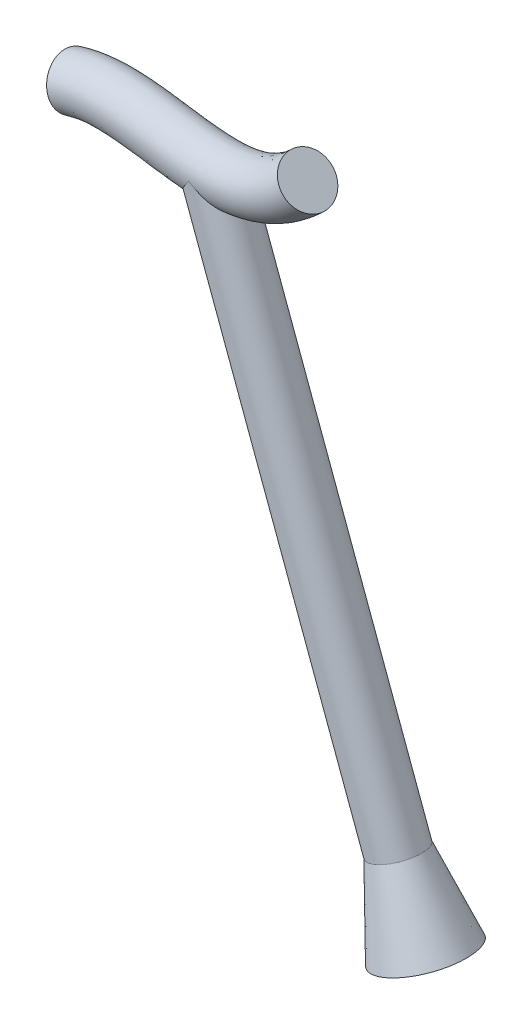
from build123d import *

# Parameters (mm, degrees)
CROQUIS8_R              = 12.5
SALIENTE_EXTRUIR1_REACH = 326.791
CROQUIS11_R             = 12.5


with BuildPart() as part:
    # Barrer2: sweep along a path in Croquis7
    with BuildLine() as barrer2_path:  # in the path sketch's own coordinates; laid on its plane below (add() does not lay a ready-made edge on the line's plane)
        add(Edge.make_bspline(
            [(0, 0), (40.063845147, 12.936685998), (79.927373916, -21.140368078), (118.219501425, 15.689998663)],
            knots=[0, 0, 0, 0, 1, 1, 1, 1], degree=3))
    # Croquis8 → Barrer2 (sweep)
    with BuildSketch(Plane(origin=(0, 0, 0), x_dir=(0, 0, -1), z_dir=(0.9516192950583919, 0.30727954255460815, 0))):
        Circle(CROQUIS8_R)
    sweep(path=Plane.XY * barrer2_path.line)

    # Croquis11 → Saliente-Extruir1 (add, up to next)
    with BuildSketch(Plane(origin=(163.655125908, -253.290566887, 0), x_dir=(0.9381132106931296, 0.34632875122205475, 0), z_dir=(-0.34632875122205475, 0.9381132106931296, 0)), mode=Mode.PRIVATE) as saliente_extruir1_sk1:
        with Locations(Location((0, 0, 0), (0, 0, 90))):
            Circle(CROQUIS11_R)
    saliente_extruir1_tool1 = extrude(saliente_extruir1_sk1.sketch, amount=SALIENTE_EXTRUIR1_REACH, mode=Mode.PRIVATE) - part.part
    add(saliente_extruir1_tool1.solids().sort_by_distance((163.655126, -253.290567, 0))[0])

    # Croquis12 → Revolución3 (revolve)
    with BuildSketch(Plane.XY):
        Polygon((163.655125908, -253.290566887), (175.381541042, -248.961457497), (198.146766592, -283.195862788), (177.508275957, -290.815095315), align=None)
    revolve(axis=Axis((177.508275957, -290.815095315, 0), (-0.34632875122205564, 0.9381132106931294, 0)))


solid = part.part
